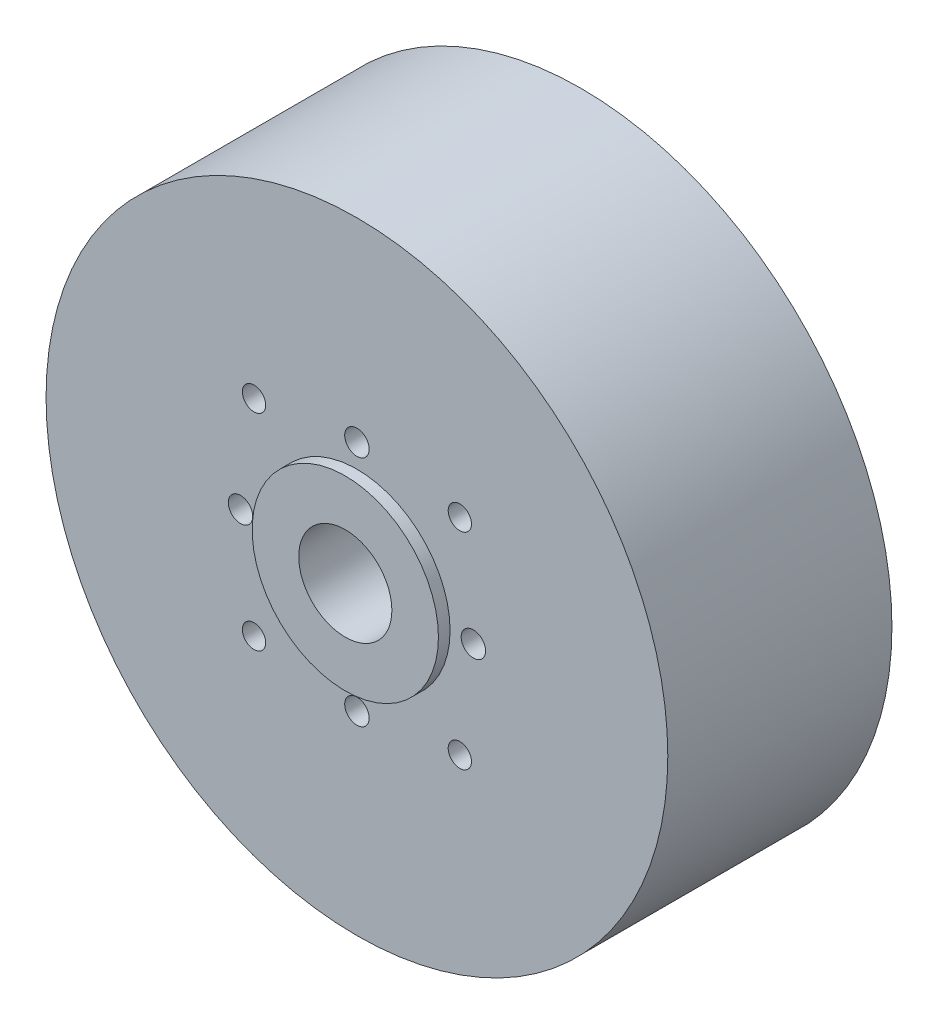
from build123d import *

# Parameters (mm, degrees)
SKETCH3_R           = 53.4
BOSS_EXTRUDE1_DEPTH = 38.5
SKETCH4_R           = 8
CUT_EXTRUDE1_DEPTH  = 85.766561804
SKETCH5_R           = 2
CUT_EXTRUDE2_DEPTH  = 20
BOSS_EXTRUDE3_START = 2
SKETCH6_R           = 16
SKETCH6_R_2         = 8
BOSS_EXTRUDE3_DEPTH = 2
SKETCH7_R           = 2.1
CUT_EXTRUDE3_DEPTH  = 20
SKETCH8_R           = 2.5
CUT_EXTRUDE4_DEPTH  = 20


with BuildPart() as part:
    # Sketch3 → Boss-Extrude1 (new body)
    with BuildSketch(Plane.XY):
        Circle(SKETCH3_R)
    extrude(amount=-BOSS_EXTRUDE1_DEPTH)

    # Sketch4 → Cut-Extrude1 (cut, through all)
    with BuildSketch(Plane.XY):
        Circle(SKETCH4_R)
    extrude(amount=-CUT_EXTRUDE1_DEPTH, mode=Mode.SUBTRACT)

    # Sketch5 → Cut-Extrude2 (cut)
    with BuildSketch(Plane.XY):
        with Locations((-17.67766953, 17.67766953)):
            Circle(SKETCH5_R)
        with Locations((17.67766953, 17.67766953)):
            Circle(SKETCH5_R)
        with Locations((-17.67766953, -17.67766953)):
            Circle(SKETCH5_R)
        with Locations((17.67766953, -17.67766953)):
            Circle(SKETCH5_R)
    extrude(amount=-CUT_EXTRUDE2_DEPTH, mode=Mode.SUBTRACT)

    # Sketch6 → Boss-Extrude3 (add)
    with BuildSketch(Plane.XY.offset(BOSS_EXTRUDE3_START)):
        Circle(SKETCH6_R)
        Circle(SKETCH6_R_2, mode=Mode.SUBTRACT)
    extrude(amount=-BOSS_EXTRUDE3_DEPTH)

    # Sketch7 → Cut-Extrude3 (cut)
    with BuildSketch(Plane.XY):
        with Locations((0, 20)):
            Circle(SKETCH7_R)
        with Locations((20, 0)):
            Circle(SKETCH7_R)
        with Locations((-20, 0)):
            Circle(SKETCH7_R)
        with Locations((0, -20)):
            Circle(SKETCH7_R)
    extrude(amount=-CUT_EXTRUDE3_DEPTH, mode=Mode.SUBTRACT)

    # Sketch8 → Cut-Extrude4 (cut)
    with BuildSketch(Plane(origin=(0, 0, -38.5), x_dir=(-1, 0, 0), z_dir=(0, 0, -1))):
        with Locations((0, 30)):
            Circle(SKETCH8_R)
        with Locations((30, 0)):
            Circle(SKETCH8_R)
        with Locations((0, -30)):
            Circle(SKETCH8_R)
        with Locations((-30, 0)):
            Circle(SKETCH8_R)
    extrude(amount=-CUT_EXTRUDE4_DEPTH, mode=Mode.SUBTRACT)


solid = part.part
